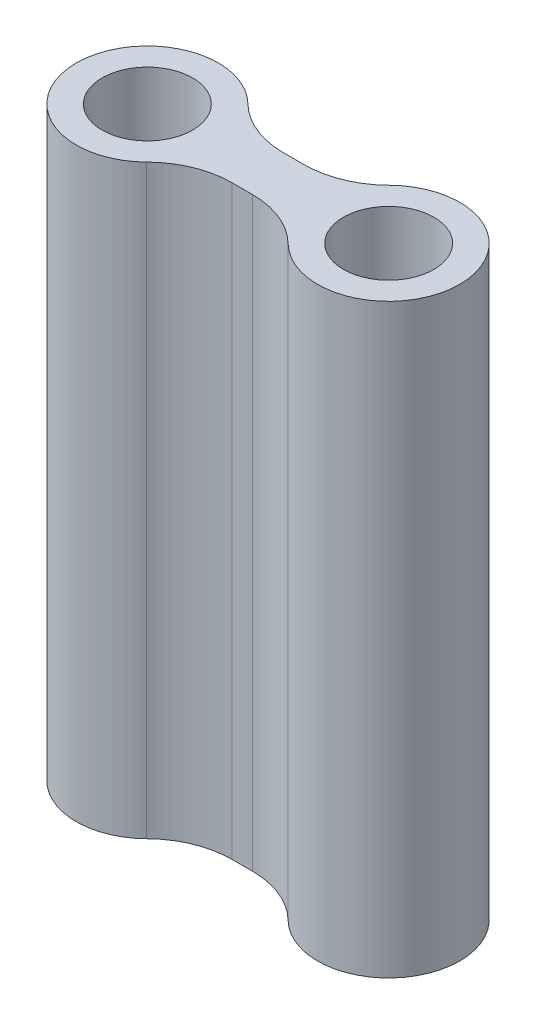
from build123d import *

# Parameters (mm, degrees)
SKETCH1_R           = 2.625
BOSS_EXTRUDE1_DEPTH = 34


with BuildPart() as part:
    # Sketch1 → Boss-Extrude1 (new body)
    with BuildSketch(Plane(origin=(0, 0, 0), x_dir=(1, 0, 0), z_dir=(0, 1, 0))):
        with BuildLine():
            Line((-7.595655771, 1.5), (-6.404344229, 1.5))
            ThreePointArc((-6.404344229, 1.5), (-4.508060914, 1.873542436), (-2.895114514, 2.938356164))
            ThreePointArc((-2.895114514, 2.938356164), (4.125, 0), (-2.895114514, -2.938356164))
            ThreePointArc((-2.895114514, -2.938356164), (-4.508060914, -1.873542436), (-6.404344229, -1.5))
            Line((-6.404344229, -1.5), (-7.595655771, -1.5))
            ThreePointArc((-7.595655771, -1.5), (-9.491939086, -1.873542436), (-11.104885486, -2.938356164))
            ThreePointArc((-11.104885486, -2.938356164), (-18.125, 0), (-11.104885486, 2.938356164))
            ThreePointArc((-11.104885486, 2.938356164), (-9.491939086, 1.873542436), (-7.595655771, 1.5))
        make_face()
        with Locations(Location((0, 0, 0), (0, 0, 270))):
            Circle(SKETCH1_R, mode=Mode.SUBTRACT)
        with Locations(Location((-14, 0, 0), (0, 0, 270))):
            Circle(SKETCH1_R, mode=Mode.SUBTRACT)
    extrude(amount=BOSS_EXTRUDE1_DEPTH)


solid = part.part
